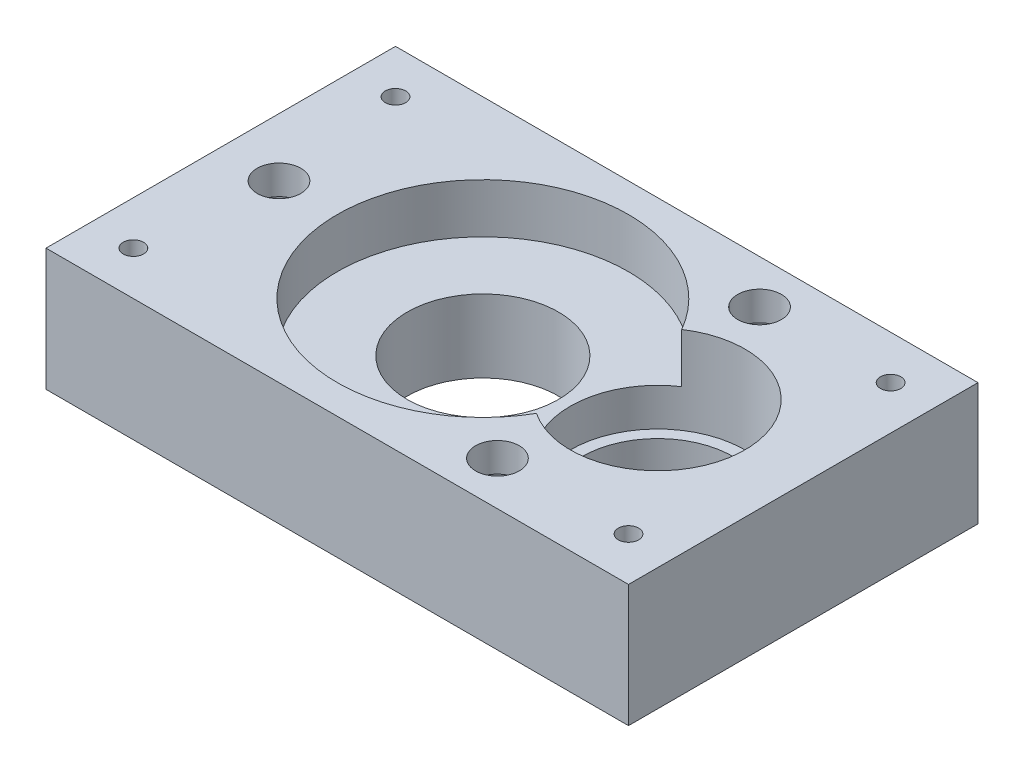
from build123d import *

# Parameters (mm, degrees)
SKETCH_1_W               = 20
SKETCH_1_H               = 12
EXTRUDE_1_DEPTH          = 3
EXTRUDE_3_DEPTH          = 1.3
EXTRUDE_3_DEPTH_BACK     = 1.2
SKETCH_1_13_W            = 20
SKETCH_1_13_H            = 12
SKETCH_1_13_R            = 2.6
SKETCH_1_13_R_2          = 3
EXTRUDE_START            = -1.2
SKETCH_1_14_W            = 20
SKETCH_1_14_H            = 12
SKETCH_1_14_R            = 2.6
EXTRUDE_4_DEPTH          = 1.2
CUT_EXTRUDE_3_DEPTH      = 24.515952033
CUT_EXTRUDE_3_DEPTH_BACK = 24.515952033
SKETCH_3_R               = 0.75
SKETCH_3_R_2             = 0.35
CUT_EXTRUDE_START        = -1.2
SKETCH_3_4_R             = 1
CUT_EXTRUDE_4_DEPTH      = 3.2


with BuildPart() as part:
    # 草图1 → 凸台-拉伸1 (new body)
    with BuildSketch(Plane(origin=(0, 0, 0), x_dir=(1, 0, 0), z_dir=(0, 1, 0))):
        with Locations((10, -6)):
            Rectangle(SKETCH_1_W, SKETCH_1_H)
        with BuildLine():
            ThreePointArc((13.333333333, -3.505561742), (18, -6), (13.333333333, -8.494438258))
            ThreePointArc((13.333333333, -8.494438258), (4, -6), (13.333333333, -3.505561742))
        make_face(mode=Mode.SUBTRACT)
    extrude(amount=EXTRUDE_1_DEPTH)

    # 草图1<13> → 凸台-拉伸3 (add, two sides: drawn at the far end of the back side and taken through both)
    with BuildSketch(Plane(origin=(0, 0, 0), x_dir=(1, 0, 0), z_dir=(0, 1, 0)).offset(-EXTRUDE_3_DEPTH_BACK)):
        with Locations((10, -6)):
            Rectangle(SKETCH_1_13_W, SKETCH_1_13_H)
        with Locations(Location((9, -6, 0), (0, 0, 270))):
            Circle(SKETCH_1_13_R, mode=Mode.SUBTRACT)
        with Locations(Location((15, -6, 0), (0, 0, 123.748988596))):
            Circle(SKETCH_1_13_R_2, mode=Mode.SUBTRACT)
    extrude(amount=EXTRUDE_3_DEPTH + EXTRUDE_3_DEPTH_BACK)

    # 草图1<14> → 凸台-拉伸4 (add)
    with BuildSketch(Plane(origin=(0, 0, 0), x_dir=(1, 0, 0), z_dir=(0, 1, 0)).offset(EXTRUDE_START)):
        with Locations((10, -6)):
            Rectangle(SKETCH_1_14_W, SKETCH_1_14_H)
        with Locations(Location((15, -6, 0), (0, 0, 270))):
            Circle(SKETCH_1_14_R, mode=Mode.SUBTRACT)
        with Locations(Location((9, -6, 0), (0, 0, 270))):
            Circle(SKETCH_1_14_R, mode=Mode.SUBTRACT)
    extrude(amount=EXTRUDE_4_DEPTH)

    # 草图3 → 切除-拉伸3 (cut, two sides: drawn at the far end of the back side and taken through both)
    with BuildSketch(Plane(origin=(0, 0, 0), x_dir=(1, 0, 0), z_dir=(0, 1, 0)).offset(-CUT_EXTRUDE_3_DEPTH_BACK)):
        with Locations(Location((2, -6, 0), (0, 0, 270))):
            Circle(SKETCH_3_R)
        with Locations(Location((14, -1.5, 0), (0, 0, 270))):
            Circle(SKETCH_3_R)
        with Locations(Location((14, -10.5, 0), (0, 0, 270))):
            Circle(SKETCH_3_R)
        with Locations(Location((1.5, -1.5, 0), (0, 0, 270))):
            Circle(SKETCH_3_R_2)
        with Locations(Location((18.5, -1.5, 0), (0, 0, 270))):
            Circle(SKETCH_3_R_2)
        with Locations(Location((1.5, -10.5, 0), (0, 0, 270))):
            Circle(SKETCH_3_R_2)
        with Locations(Location((18.5, -10.5, 0), (0, 0, 270))):
            Circle(SKETCH_3_R_2)
    extrude(amount=CUT_EXTRUDE_3_DEPTH + CUT_EXTRUDE_3_DEPTH_BACK, mode=Mode.SUBTRACT)

    # 草图3<4> → 切除-拉伸4 (cut)
    with BuildSketch(Plane(origin=(0, 0, 0), x_dir=(1, 0, 0), z_dir=(0, 1, 0)).offset(CUT_EXTRUDE_START)):
        with Locations(Location((2, -6, 0), (0, 0, 270))):
            Circle(SKETCH_3_4_R)
        with Locations(Location((14, -1.5, 0), (0, 0, 270))):
            Circle(SKETCH_3_4_R)
        with Locations(Location((14, -10.5, 0), (0, 0, 270))):
            Circle(SKETCH_3_4_R)
    extrude(amount=CUT_EXTRUDE_4_DEPTH, mode=Mode.SUBTRACT)


solid = part.part
